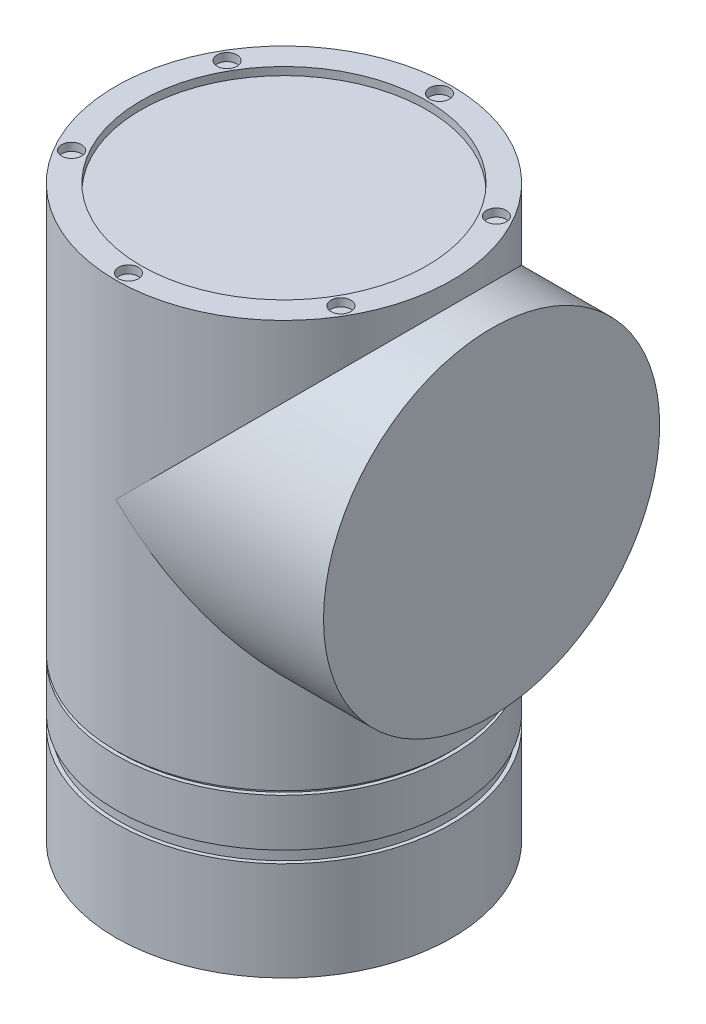
from build123d import *

# Parameters (mm, degrees)
CROQUIS1_R              = 42.5
SALIENTE_EXTRUIR1_DEPTH = 142
CROQUIS2_R              = 42.5
SALIENTE_EXTRUIR2_DEPTH = 52.5
CROQUIS3_R              = 42.5
CROQUIS3_R_2            = 36.143595246
CROQUIS3_R_3            = 2.508178933
SALIENTE_EXTRUIR3_DEPTH = 2
CORTAR_EXTRUIR1_START   = -25
CROQUIS6_R              = 42.5
CROQUIS6_R_2            = 41.546105734
CORTAR_EXTRUIR1_DEPTH   = 3
CORTAR_EXTRUIR2_START   = -40
CROQUIS7_R              = 42.5
CROQUIS7_R_2            = 41.546105734
CORTAR_EXTRUIR2_DEPTH   = 1
CORTAR_EXTRUIR3_START   = -30
CROQUIS8_R              = 7.355169738
CORTAR_EXTRUIR3_DEPTH   = 21


with BuildPart() as part:
    # Croquis1 → Saliente-Extruir1 (new body)
    with BuildSketch(Plane(origin=(0, 0, 0), x_dir=(1, 0, 0), z_dir=(0, 1, 0))):
        with Locations(Location((0, 0, 0), (0, 0, 270))):
            Circle(CROQUIS1_R)
    extrude(amount=SALIENTE_EXTRUIR1_DEPTH)

    # Croquis2 → Saliente-Extruir2 (add)
    with BuildSketch(Plane(origin=(0, 0, 0), x_dir=(0, 0, -1), z_dir=(1, 0, 0))):
        with Locations((0, 96)):
            Circle(CROQUIS2_R)
    extrude(amount=SALIENTE_EXTRUIR2_DEPTH)

    # Croquis3 → Saliente-Extruir3 (add)
    with BuildSketch(Plane(origin=(0, 142, 0), x_dir=(1, 0, 0), z_dir=(0, 1, 0))):
        with Locations(Location((0, 0, 0), (0, 0, 270))):
            Circle(CROQUIS3_R)
        with Locations(Location((0, 0, 0), (0, 0, 270))):
            Circle(CROQUIS3_R_2, mode=Mode.SUBTRACT)
        with Locations(Location((0, 39.319059372, 0), (0, 0, 270))):
            Circle(CROQUIS3_R_3, mode=Mode.SUBTRACT)
        with Locations(Location((34.051304269, 19.659529686, 0), (0, 0, 270))):
            Circle(CROQUIS3_R_3, mode=Mode.SUBTRACT)
        with Locations(Location((34.051304269, -19.659529686, 0), (0, 0, 270))):
            Circle(CROQUIS3_R_3, mode=Mode.SUBTRACT)
        with Locations(Location((0, -39.319059372, 0), (0, 0, 270))):
            Circle(CROQUIS3_R_3, mode=Mode.SUBTRACT)
        with Locations(Location((-34.051304269, -19.659529686, 0), (0, 0, 270))):
            Circle(CROQUIS3_R_3, mode=Mode.SUBTRACT)
        with Locations(Location((-34.051304269, 19.659529686, 0), (0, 0, 270))):
            Circle(CROQUIS3_R_3, mode=Mode.SUBTRACT)
    extrude(amount=SALIENTE_EXTRUIR3_DEPTH)

    # Croquis6 → Cortar-Extruir1 (cut)
    with BuildSketch(Plane.XZ.offset(CORTAR_EXTRUIR1_START)):
        with Locations(Location((0, 0, 0), (0, 0, 270))):
            Circle(CROQUIS6_R)
        with Locations(Location((0, 0, 0), (0, 0, 270))):
            Circle(CROQUIS6_R_2, mode=Mode.SUBTRACT)
    extrude(amount=-CORTAR_EXTRUIR1_DEPTH, mode=Mode.SUBTRACT)

    # Croquis7 → Cortar-Extruir2 (cut)
    with BuildSketch(Plane(origin=(0, 0, 0), x_dir=(-1, 0, 0), z_dir=(0, -1, 0)).offset(CORTAR_EXTRUIR2_START)):
        with Locations(Location((0, 0, 0), (0, 0, 90))):
            Circle(CROQUIS7_R)
        with Locations(Location((0, 0, 0), (0, 0, 90))):
            Circle(CROQUIS7_R_2, mode=Mode.SUBTRACT)
    extrude(amount=-CORTAR_EXTRUIR2_DEPTH, mode=Mode.SUBTRACT)

    # Croquis8 → Cortar-Extruir3 (cut)
    with BuildSketch(Plane.XY.offset(CORTAR_EXTRUIR3_START)):
        with Locations((0, 12.368172151)):
            Circle(CROQUIS8_R)
    extrude(amount=-CORTAR_EXTRUIR3_DEPTH, mode=Mode.SUBTRACT)


solid = part.part
